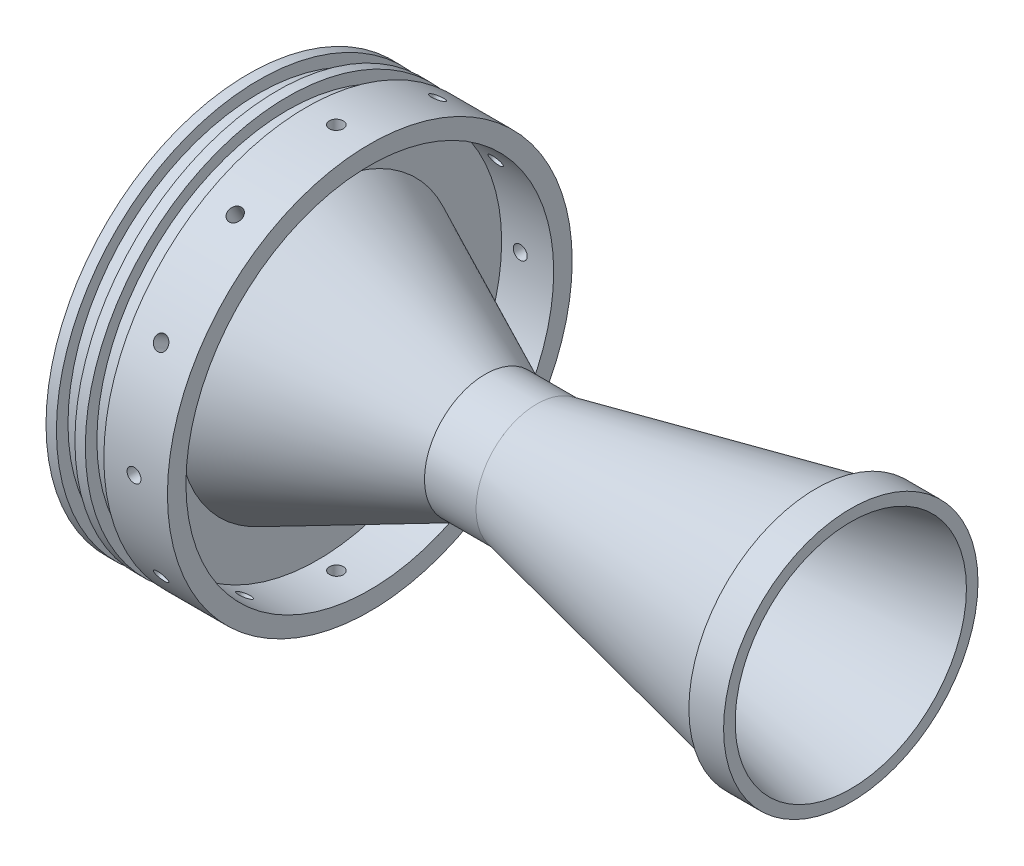
from build123d import *

# Parameters (mm, degrees)
SKETCH3_R          = 12
CUT_EXTRUDE1_DEPTH = 96
CIRPATTERN1_COUNT  = 12
SCALE1_SCALE       = 0.1


with BuildPart() as part:
    # Sketch1 → Revolve1 (revolve)
    with BuildSketch(Plane.XY, mode=Mode.PRIVATE) as revolve1_sk:
        Polygon((0, 0), (0, -60), (18, -60), (18, -40), (50, -40), (50, -60), (68, -60), (68, -40), (100, -40), (100, -60), (210, -60), (210, -28), (120, -28), (120, 50), (409.508434269, 185), (498.666555561, 185), (981.801102856, 82.306581803), (981.801102856, 70), (1041.801102856, 70), (1041.801102856, 90), (406.676038076, 225), (396.676038076, 225), (75, 75), align=None)
    revolve(revolve1_sk.sketch.rotate(Axis((-108.967336554, 290, 0), (1, 0, 0)), 270), axis=Axis((-108.967336554, 290, 0), (1, 0, 0)))

    # Sketch3 → Cut-Extrude1 (cut)
    with BuildSketch(Plane(origin=(0, 0, 0), x_dir=(1, 0, 0), z_dir=(0, 1, 0))):
        with Locations(Location((152.2, 0, 0), (0, 0, 270))):
            Circle(SKETCH3_R)
    cut_extrude1 = extrude(amount=-CUT_EXTRUDE1_DEPTH, mode=Mode.SUBTRACT)

    # CirPattern1: Cut-Extrude1 ×12 about axis
    cirpattern1_axis = Axis((-108.967336554, 290, 0), (-1, 0, 0))
    for i in range(1, CIRPATTERN1_COUNT):
        add(cut_extrude1.rotate(cirpattern1_axis, i * 360 / CIRPATTERN1_COUNT), mode=Mode.SUBTRACT)


with BuildPart() as part_1:
    # Scale1: scaled about (285.641138791, 290.000408521, 5.9888e-05)
    add(part.part.scale(SCALE1_SCALE).moved(Location((257.077024912, 261.000367669, 5.3899e-05))))


solid = part_1.part
